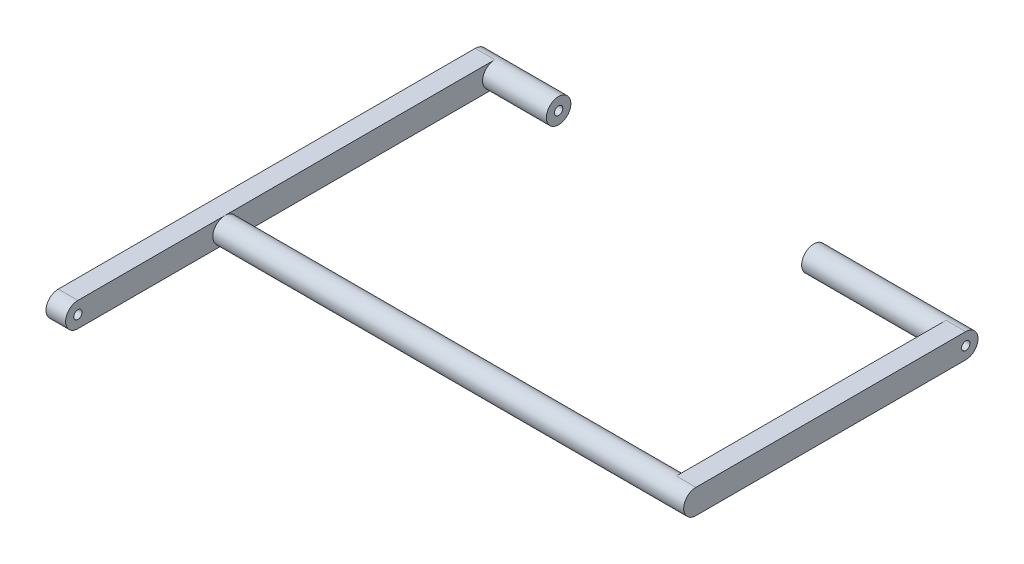
from build123d import *

# Parameters (mm, degrees)
RESSALTO_EXTRUS_O1_DEPTH   = 4
RESSALTO_EXTRUS_O2_START   = 26.96
ESBO_O2_R                  = 2.5
RESSALTO_EXTRUS_O2_DEPTH   = 26.96
RESSALTO_EXTRUS_O3_START   = 92
ESBO_O5_R                  = 2.5
RESSALTO_EXTRUS_O3_DEPTH   = 92
RESSALTO_EXTRUS_O4_START   = 4
RESSALTO_EXTRUS_O4_DEPTH   = 4
ESBO_O7_R                  = 2.5
RESSALTO_EXTRUS_O5_DEPTH   = 13
RESSALTO_EXTRUS_O6_START   = -4
RESSALTO_EXTRUS_O6_DEPTH   = 4
CORTE_EXTRUS_O1_DEPTH      = 92.502850229
CORTE_EXTRUS_O1_DEPTH_BACK = 92.502850229
ESBO_O3_R                  = 0.85
CORTE_EXTRUS_O2_DEPTH      = 117.645831473
CORTE_EXTRUS_O2_DEPTH_BACK = 117.645831473
ESBO_O4_R                  = 0.85


with BuildPart() as part:
    # Esboço1 → Ressalto-extrusão1 (new body)
    with BuildSketch(Plane(origin=(0, 0, 0), x_dir=(0, 0, -1), z_dir=(1, 0, 0))):
        with BuildLine():
            Line((-27.5, 2.5), (27.5, 2.5))
            ThreePointArc((27.5, 2.5), (30, 0), (27.5, -2.5))
            Line((27.5, -2.5), (-27.5, -2.5))
            ThreePointArc((-27.5, -2.5), (-30, 0), (-27.5, 2.5))
        make_face()
    extrude(amount=RESSALTO_EXTRUS_O1_DEPTH)

    # Esboço2 → Ressalto-extrusão2 (add)
    with BuildSketch(Plane.ZY.offset(RESSALTO_EXTRUS_O2_START)):
        with Locations((-27.5, 0)):
            Circle(ESBO_O2_R)
    extrude(amount=-RESSALTO_EXTRUS_O2_DEPTH)

    # Esboço5 → Ressalto-extrusão3 (add)
    with BuildSketch(Plane.ZY.offset(RESSALTO_EXTRUS_O3_START)):
        with Locations((27.5, 0)):
            Circle(ESBO_O5_R)
    extrude(amount=-RESSALTO_EXTRUS_O3_DEPTH)

    # Esboço6 → Ressalto-extrusão4 (add)
    with BuildSketch(Plane.ZY.offset(92).offset(RESSALTO_EXTRUS_O4_START)):
        with BuildLine():
            Line((27.5, -2.5), (-27.5, -2.5))
            ThreePointArc((-27.5, -2.5), (-30, 0), (-27.5, 2.5))
            Line((-27.5, 2.5), (27.5, 2.5))
            ThreePointArc((27.5, 2.5), (30, 0), (27.5, -2.5))
        make_face()
    extrude(amount=-RESSALTO_EXTRUS_O4_DEPTH)

    # Esboço7 → Ressalto-extrusão5 (add)
    with BuildSketch(Plane(origin=(-92, 0, 0), x_dir=(0, 0, -1), z_dir=(1, 0, 0))):
        with Locations(Location((27.5, 0, 0), (0, 0, 180))):
            Circle(ESBO_O7_R)
    extrude(amount=RESSALTO_EXTRUS_O5_DEPTH)

    # Esboço8 → Ressalto-extrusão6 (add)
    with BuildSketch(Plane(origin=(-92, 0, 0), x_dir=(0, 0, -1), z_dir=(1, 0, 0)).offset(RESSALTO_EXTRUS_O6_START)):
        with BuildLine():
            Line((-27.5, -2.5), (-57.5, -2.5))
            ThreePointArc((-57.5, -2.5), (-60, 0), (-57.5, 2.5))
            Line((-57.5, 2.5), (-27.5, 2.5))
            ThreePointArc((-27.5, 2.5), (-25, 0), (-27.5, -2.5))
        make_face()
    extrude(amount=RESSALTO_EXTRUS_O6_DEPTH)

    # Esboço3 → Corte-extrusão1 (cut, two sides: drawn at the far end of the back side and taken through both)
    with BuildSketch(Plane.ZY.offset(26.96).offset(-CORTE_EXTRUS_O1_DEPTH_BACK)):
        with Locations((-27.5, 0)):
            Circle(ESBO_O3_R)
    extrude(amount=CORTE_EXTRUS_O1_DEPTH + CORTE_EXTRUS_O1_DEPTH_BACK, mode=Mode.SUBTRACT)

    # Esboço4 → Corte-extrusão2 (cut, two sides: drawn at the far end of the back side and taken through both)
    with BuildSketch(Plane.ZY.offset(96).offset(-CORTE_EXTRUS_O2_DEPTH_BACK)):
        with Locations((57.5, 0)):
            Circle(ESBO_O4_R)
    extrude(amount=CORTE_EXTRUS_O2_DEPTH + CORTE_EXTRUS_O2_DEPTH_BACK, mode=Mode.SUBTRACT)


solid = part.part
